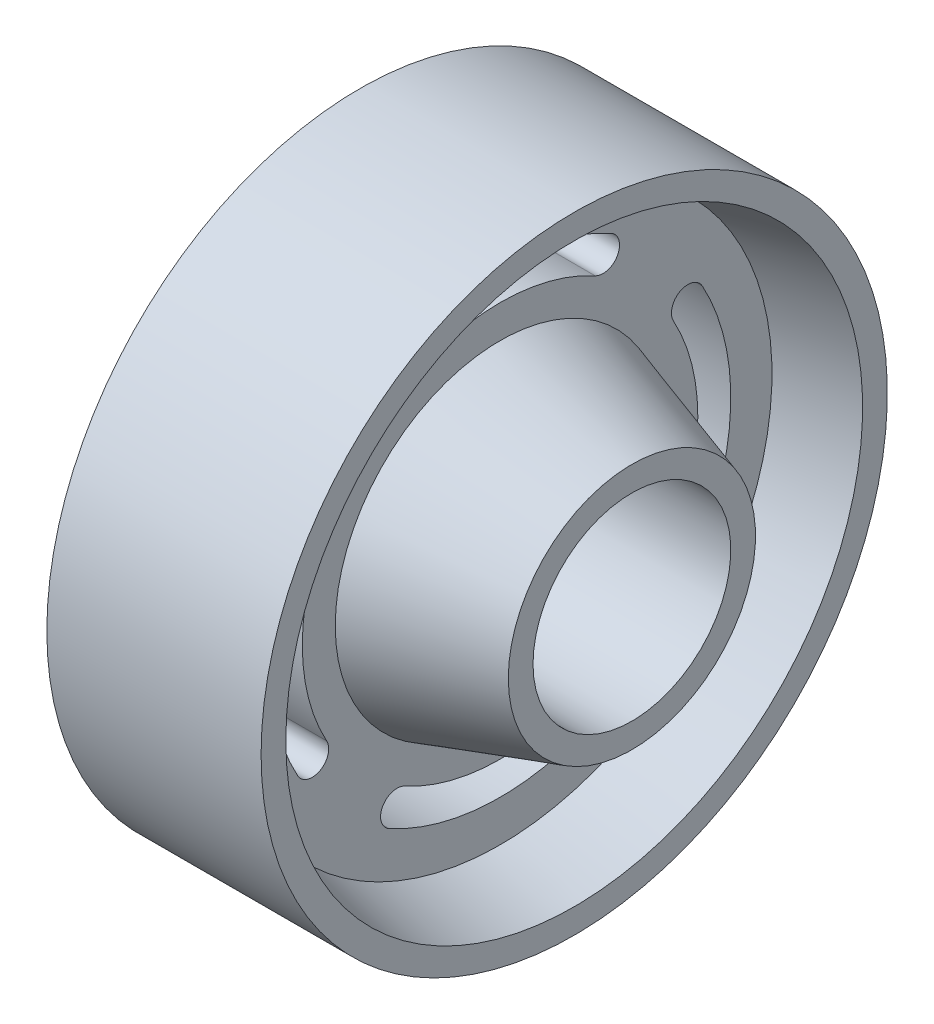
from build123d import *

# Parameters (mm, degrees)
CUT_EXTRUDE1_DEPTH = 59.855755878
CIRPATTERN1_COUNT  = 4


with BuildPart() as part:
    # Sketch1 → Revolve1 (revolve)
    with BuildSketch(Plane.XY, mode=Mode.PRIVATE) as revolve1_sk:
        Polygon((-13, 38), (13, 38), (13, 35), (4, 33), (4, 20), (20, 15), (20, 12), (-20, 12), (-20, 15), (-4, 20), (-4, 33), (-13, 35), align=None)
    revolve(revolve1_sk.sketch.rotate(Axis((0, 0, 0), (1, 0, 0)), 90), axis=Axis((0, 0, 0), (1, 0, 0)))

    # Sketch2 → Cut-Extrude1 (cut, symmetric)
    with BuildSketch(Plane.ZY.offset(4)):
        with BuildLine():
            ThreePointArc((13.461538462, 24.551720556), (0, 28), (-13.461538462, 24.551720556))
            ThreePointArc((-13.461538462, 24.551720556), (-14.253694325, 21.836487769), (-11.538461538, 21.044331905))
            ThreePointArc((-11.538461538, 21.044331905), (0, 24), (11.538461538, 21.044331905))
            ThreePointArc((11.538461538, 21.044331905), (14.253694325, 21.836487769), (13.461538462, 24.551720556))
        make_face()
    cut_extrude1 = extrude(amount=CUT_EXTRUDE1_DEPTH, both=True, mode=Mode.SUBTRACT)

    # CirPattern1: Cut-Extrude1 ×4 about axis
    cirpattern1_axis = Axis((0, 0, 0), (1, 0, 0))
    for i in range(1, CIRPATTERN1_COUNT):
        add(cut_extrude1.rotate(cirpattern1_axis, i * 360 / CIRPATTERN1_COUNT), mode=Mode.SUBTRACT)


solid = part.part
